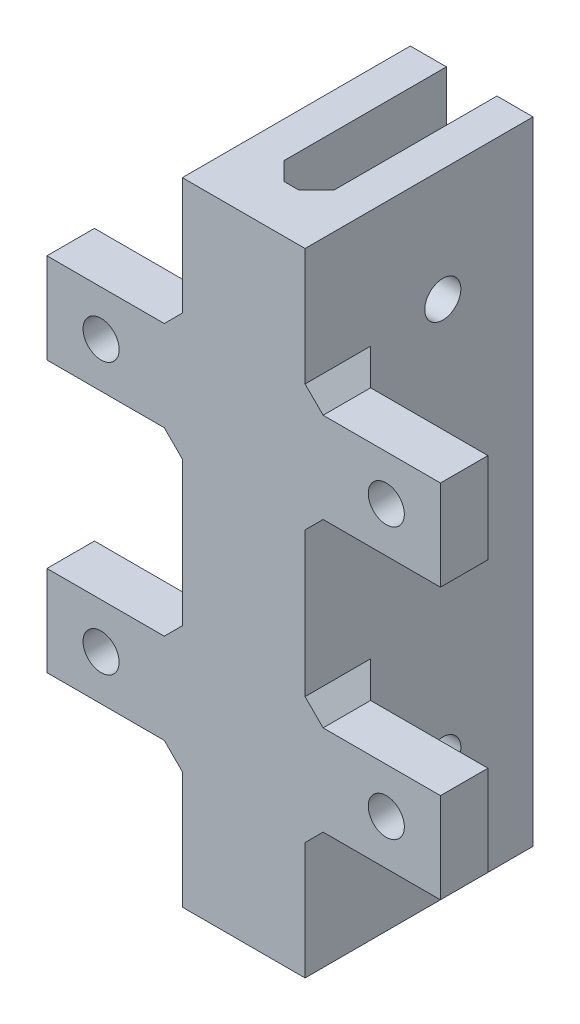
from build123d import *

# Parameters (mm, degrees)
BOSS_EXTRUDE1_DEPTH     = 70
CUT_EXTRUDE1_DEPTH      = 78.776388862
CUT_EXTRUDE1_DEPTH_BACK = 78.776388862
SKETCH2_R               = 2
SKETCH2_W               = 15
SKETCH2_H               = 15
SKETCH2_H_2             = 20
CUT_EXTRUDE2_DEPTH      = 79.217389371
CUT_EXTRUDE2_DEPTH_BACK = 79.217389371
SKETCH3_R               = 2
CHAMFER1_SIZE           = 2


with BuildPart() as part:
    # Sketch1 → Boss-Extrude1 (new body)
    with BuildSketch(Plane(origin=(0, 0, 0), x_dir=(1, 0, 0), z_dir=(0, 1, 0))):
        Polygon((-16.229090909, 0), (-1.229090909, 0), (-1.229090909, 20), (2.770909091, 20), (2.770909091, 0), (8.370909091, 0), (8.370909091, 20), (12.370909091, 20), (12.370909091, 0), (27.370909091, 0), (27.370909091, -5.261218749), (-16.229090909, -5.261218749), align=None)
    extrude(amount=BOSS_EXTRUDE1_DEPTH)

    # Sketch2 → Cut-Extrude1 (cut, two sides: drawn at the far end of the back side and taken through both)
    with BuildSketch(Plane(origin=(0, 0, 0), x_dir=(-1, 0, 0), z_dir=(0, 0, -1)).offset(-CUT_EXTRUDE1_DEPTH_BACK)):
        with Locations((-21.370909091, 50)):
            Circle(SKETCH2_R)
        with Locations(Location((10.229090909, 50, 0), (0, 0, 180))):
            Circle(SKETCH2_R)
        with Locations((10.229090909, 20)):
            Circle(SKETCH2_R)
        with Locations(Location((-21.370909091, 20, 0), (0, 0, 180))):
            Circle(SKETCH2_R)
        with Locations((-19.870909091, 62.5)):
            Rectangle(SKETCH2_W, SKETCH2_H)
        with Locations((-19.870909091, 35)):
            Rectangle(SKETCH2_W, SKETCH2_H_2)
        with Locations((8.729090909, 35)):
            Rectangle(SKETCH2_W, SKETCH2_H_2)
        with Locations((8.729090909, 62.5)):
            Rectangle(SKETCH2_W, SKETCH2_H)
        with Locations((8.729090909, 7.5)):
            Rectangle(SKETCH2_W, SKETCH2_H)
        with Locations((-19.870909091, 7.5)):
            Rectangle(SKETCH2_W, SKETCH2_H)
    extrude(amount=CUT_EXTRUDE1_DEPTH + CUT_EXTRUDE1_DEPTH_BACK, mode=Mode.SUBTRACT)

    # Sketch3 → Cut-Extrude2 (cut, two sides: drawn at the far end of the back side and taken through both)
    with BuildSketch(Plane(origin=(12.370909091, 0, 0), x_dir=(0, 0, -1), z_dir=(1, 0, 0)).offset(-CUT_EXTRUDE2_DEPTH_BACK)):
        with Locations((10, 57.5)):
            Circle(SKETCH3_R)
        with Locations((10, 35.5)):
            Circle(SKETCH3_R)
        with Locations((10, 13.5)):
            Circle(SKETCH3_R)
    extrude(amount=CUT_EXTRUDE2_DEPTH + CUT_EXTRUDE2_DEPTH_BACK, mode=Mode.SUBTRACT)

    # Chamfer1
    chamfer1_edges = [part.edges().sort_by_distance(p)[0] for p in [
        (-1.229090909, 25, 2.630609375),
        (12.370909091, 25, 2.630609375),
        (12.370909091, 45, 2.630609375),
        (12.370909091, 55, 2.630609375),
        (2.770909091, 35, 0),
        (8.370909091, 35, 0),
        (12.370909091, 50, 0),
        (12.370909091, 20, 0),
        (-1.229090909, 50, 0),
        (-1.229090909, 20, 0),
        (12.370909091, 15, 2.630609375),
        (-1.229090909, 15, 2.630609375),
        (-1.229090909, 55, 2.630609375),
        (-1.229090909, 45, 2.630609375),
    ]]
    chamfer(chamfer1_edges, length=CHAMFER1_SIZE)


solid = part.part
